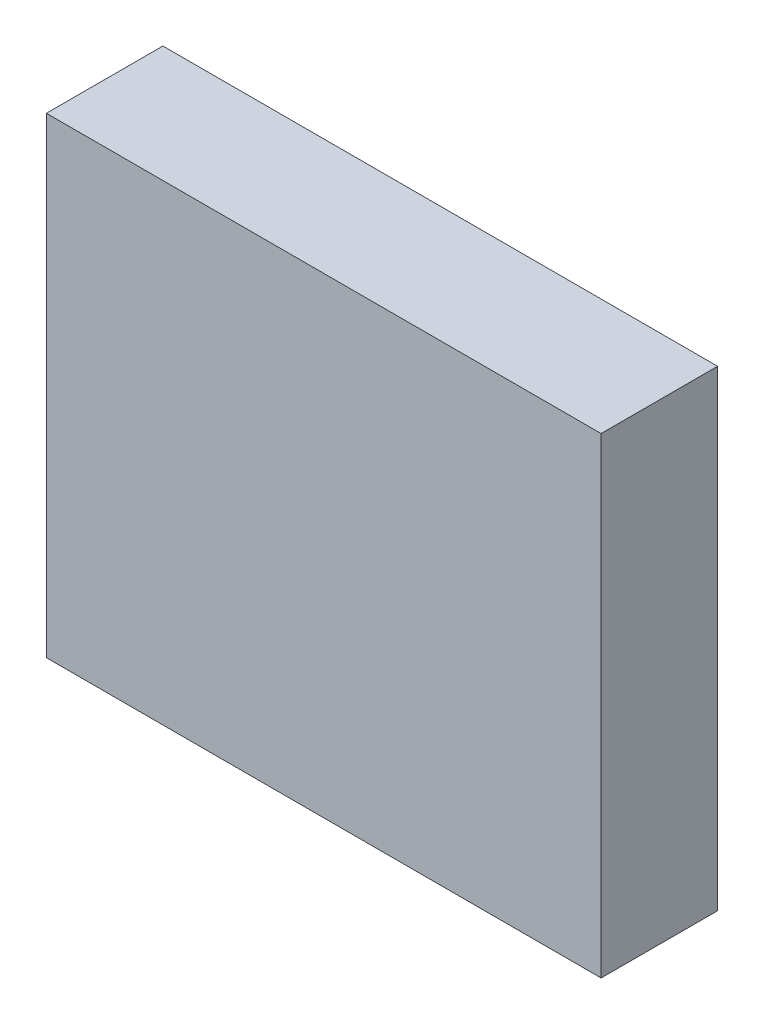
from build123d import *

# Parameters (mm, degrees)
SKETCH1_W           = 25.4
SKETCH1_H           = 21.59
BOSS_EXTRUDE1_DEPTH = 5.334


with BuildPart() as part:
    # Sketch1 → Boss-Extrude1 (new body)
    with BuildSketch(Plane.XY):
        with Locations((12.7, -10.795)):
            Rectangle(SKETCH1_W, SKETCH1_H)
    extrude(amount=BOSS_EXTRUDE1_DEPTH)


solid = part.part
